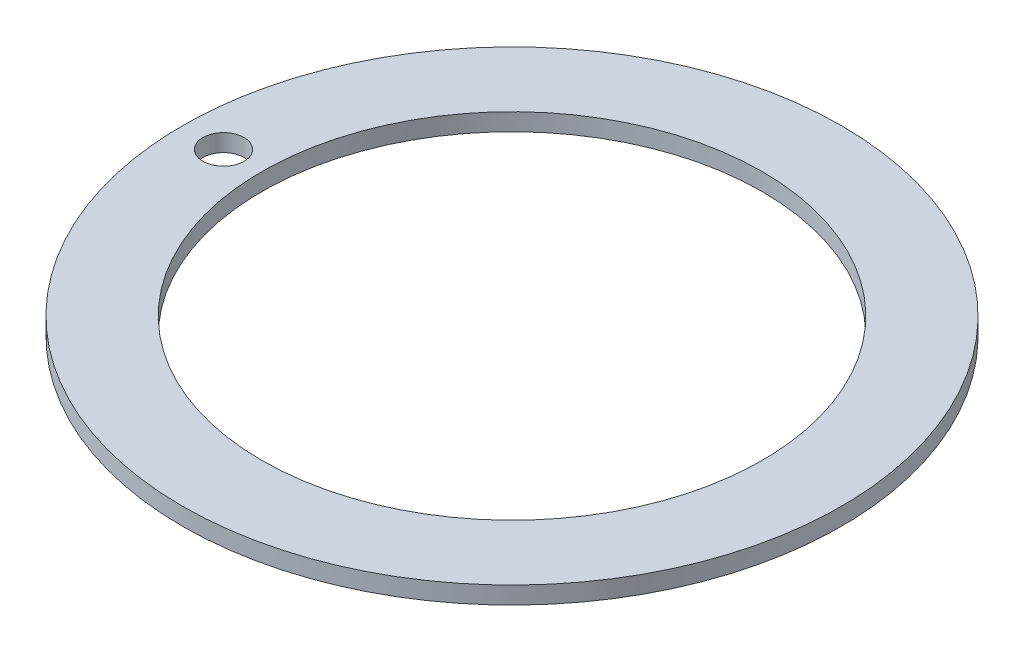
from build123d import *

# Parameters (mm, degrees)
SKETCH1_R           = 38.0746
SKETCH1_R_2         = 28.9052
BOSS_EXTRUDE1_DEPTH = 2.0066
SKETCH2_R           = 2.38125
CUT_EXTRUDE2_DEPTH  = 2.54


with BuildPart() as part:
    # Sketch1 → Boss-Extrude1 (new body)
    with BuildSketch(Plane(origin=(0, 0, 0), x_dir=(1, 0, 0), z_dir=(0, 1, 0))):
        with Locations(Location((0, 0, 0), (0, 0, 270))):
            Circle(SKETCH1_R)
        with Locations(Location((0, 0, 0), (0, 0, 270))):
            Circle(SKETCH1_R_2, mode=Mode.SUBTRACT)
    extrude(amount=BOSS_EXTRUDE1_DEPTH)

    # Sketch2 → Cut-Extrude2 (cut)
    with BuildSketch(Plane(origin=(0, 2.0066, 0), x_dir=(1, 0, 0), z_dir=(0, 1, 0))):
        with Locations(Location((-33.329941143, 0, 0), (0, 0, 270))):
            Circle(SKETCH2_R)
    extrude(amount=-CUT_EXTRUDE2_DEPTH, mode=Mode.SUBTRACT)


solid = part.part
